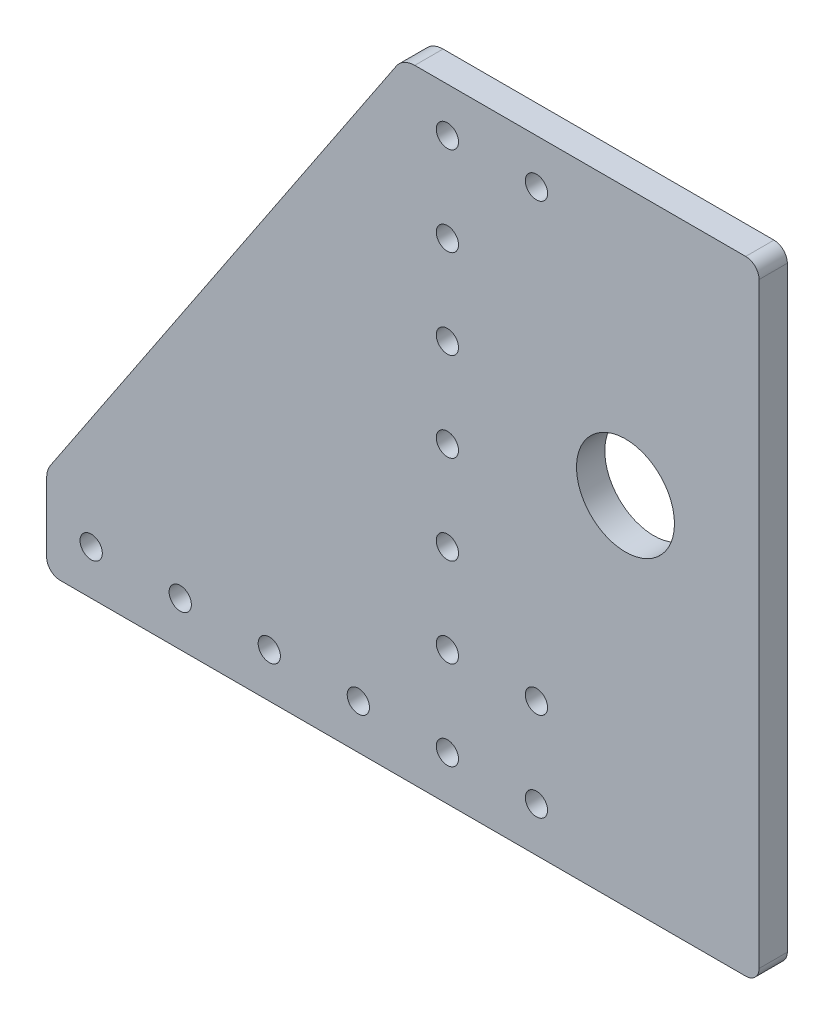
from build123d import *

# Parameters (mm, degrees)
SKETCH1_R           = 2.5
SKETCH1_R_2         = 11
BOSS_EXTRUDE1_DEPTH = 6.35
FILLET1_R           = 5
FILLET2_R           = 3


with BuildPart() as part:
    # Sketch1 → Boss-Extrude1 (new body)
    with BuildSketch(Plane.XY):
        Polygon((20, 61.824817518), (-60, 61.824817518), (-140, -58.175182482), (-140, -78.175182482), (20, -78.175182482), align=None)
        with Locations((-50, -48.175182482)):
            Circle(SKETCH1_R, mode=Mode.SUBTRACT)
        with Locations((-50, -28.175182482)):
            Circle(SKETCH1_R, mode=Mode.SUBTRACT)
        with Locations((-50, -8.175182482)):
            Circle(SKETCH1_R, mode=Mode.SUBTRACT)
        with Locations((-50, 11.824817518)):
            Circle(SKETCH1_R, mode=Mode.SUBTRACT)
        with Locations((-50, 31.824817518)):
            Circle(SKETCH1_R, mode=Mode.SUBTRACT)
        with Locations((-50, 51.824817518)):
            Circle(SKETCH1_R, mode=Mode.SUBTRACT)
        with Locations((-30, -48.175182482)):
            Circle(SKETCH1_R, mode=Mode.SUBTRACT)
        with Locations((-30, 51.824817518)):
            Circle(SKETCH1_R, mode=Mode.SUBTRACT)
        with Locations((-10, 1.824817518)):
            Circle(SKETCH1_R_2, mode=Mode.SUBTRACT)
        with Locations((-30, -68.175182482)):
            Circle(SKETCH1_R, mode=Mode.SUBTRACT)
        with Locations((-50, -68.175182482)):
            Circle(SKETCH1_R, mode=Mode.SUBTRACT)
        with Locations((-70, -68.175182482)):
            Circle(SKETCH1_R, mode=Mode.SUBTRACT)
        with Locations((-90, -68.175182482)):
            Circle(SKETCH1_R, mode=Mode.SUBTRACT)
        with Locations((-110, -68.175182482)):
            Circle(SKETCH1_R, mode=Mode.SUBTRACT)
        with Locations((-130, -68.175182482)):
            Circle(SKETCH1_R, mode=Mode.SUBTRACT)
    extrude(amount=BOSS_EXTRUDE1_DEPTH)

    # Fillet1
    fillet1_edges = [part.edges().sort_by_distance(p)[0] for p in [
        (-140, -58.175182482, 3.175),
        (-60, 61.824817518, 3.175),
    ]]
    fillet(fillet1_edges, radius=FILLET1_R)

    # Fillet2
    fillet2_edges = [part.edges().sort_by_distance(p)[0] for p in [
        (20, -78.175182482, 3.175),
        (-140, -78.175182482, 3.175),
        (20, 61.824817518, 3.175),
    ]]
    fillet(fillet2_edges, radius=FILLET2_R)


solid = part.part
